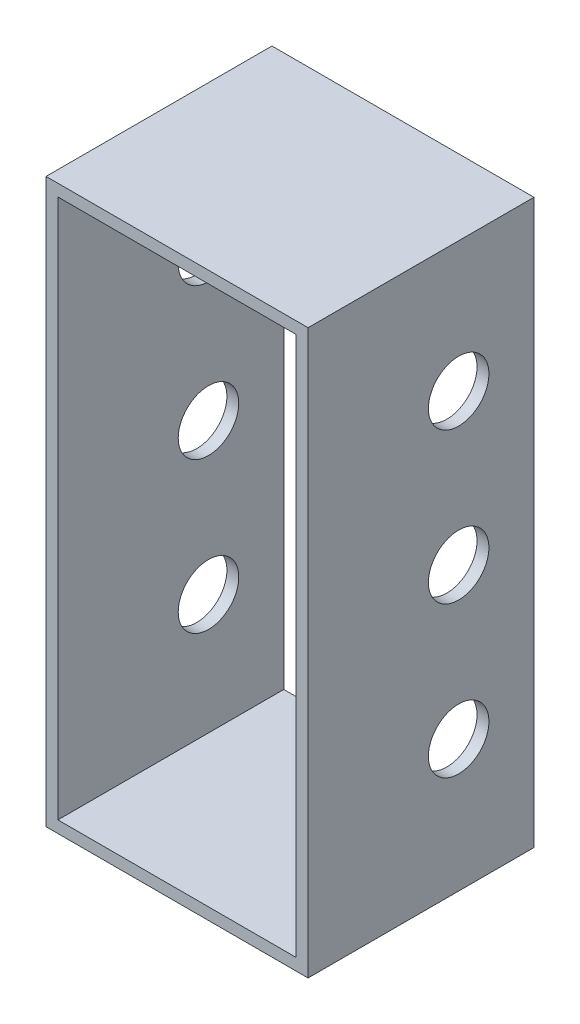
from build123d import *

# Parameters (mm, degrees)
SKETCH1_W           = 22.098
SKETCH1_H           = 19.05
BOSS_EXTRUDE1_DEPTH = 23.749
SKETCH2_R           = 2.5527
CUT_EXTRUDE1_DEPTH  = 38.619663808
SHELL1_T            = -1.000000032


with BuildPart() as part:
    # Sketch1 → Boss-Extrude1 (new, symmetric)
    with BuildSketch(Plane(origin=(0, 0, 0), x_dir=(1, 0, 0), z_dir=(0, 1, 0))):
        with Locations((11.049, 9.525)):
            Rectangle(SKETCH1_W, SKETCH1_H)
    extrude(amount=BOSS_EXTRUDE1_DEPTH, both=True)

    # Sketch2 → Cut-Extrude1 (cut, through all)
    with BuildSketch(Plane.ZY):
        with Locations((-12.7, 12.7635)):
            Circle(SKETCH2_R)
        with Locations((-12.7, -12.6365)):
            Circle(SKETCH2_R)
        with Locations((-12.7, 0.0635)):
            Circle(SKETCH2_R)
    extrude(amount=-CUT_EXTRUDE1_DEPTH, mode=Mode.SUBTRACT)

    # Shell1
    shell1_openings = [part.faces().sort_by_distance(p)[0] for p in [
        (11.049, 12.7635, -15.2527),
        (11.049, -12.6365, -15.2527),
        (11.049, 0.0635, -15.2527),
        (11.049, 0, -19.05),
        (11.049, 0, 0),
    ]]
    offset(amount=SHELL1_T, openings=shell1_openings, kind=Kind.INTERSECTION)


solid = part.part
